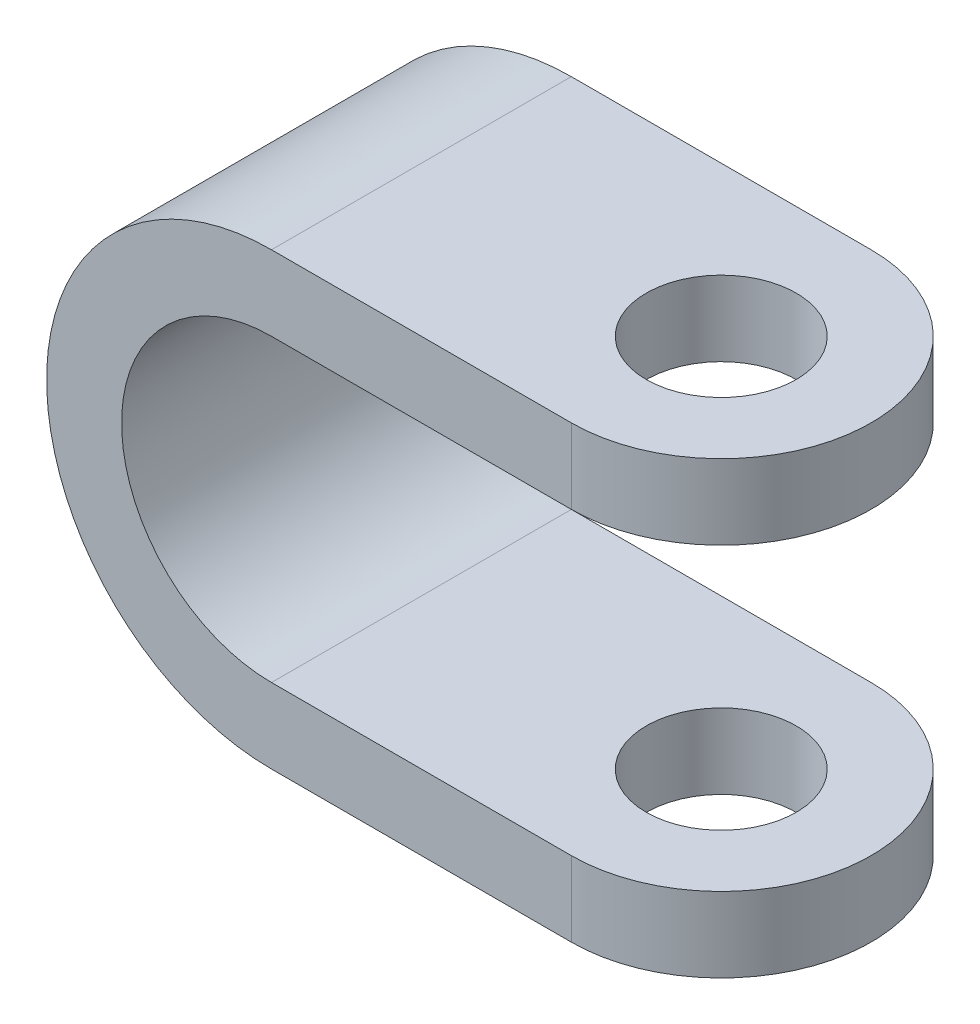
from build123d import *

# Parameters (mm, degrees)
EXTRUDE_THIN1_DEPTH = 90
SKETCH2_R           = 10
BOSS_EXTRUDE1_DEPTH = 90


with BuildPart() as part:
    # Sketch1 → Extrude-Thin1 (new body)
    with BuildSketch(Plane.XY):
        with BuildLine():
            Line((0, -15), (-60, -15))
            ThreePointArc((-60, -15), (-80, -35), (-60, -55))
            Line((-60, -55), (0, -55))
            Line((0, -55), (0, -65))
            Line((0, -65), (-60, -65))
            ThreePointArc((-60, -65), (-90, -35), (-60, -5))
            Line((-60, -5), (0, -5))
            Line((0, -5), (0, -15))
        make_face()
    extrude(amount=EXTRUDE_THIN1_DEPTH)


with BuildPart() as body_2:
    # Sketch2 → Boss-Extrude1 (new body)
    with BuildSketch(Plane(origin=(0, 0, 0), x_dir=(1, 0, 0), z_dir=(0, 1, 0))):
        with BuildLine():
            Line((-90, -25), (-90, -65))
            Line((-90, -65), (-20, -65))
            ThreePointArc((-20, -65), (0, -45), (-20, -25))
            Line((-20, -25), (-90, -25))
        make_face()
        with Locations((-20, -45)):
            Circle(SKETCH2_R, mode=Mode.SUBTRACT)
    extrude(amount=-BOSS_EXTRUDE1_DEPTH)

    # Combine1: intersect part
    add(part.part, mode=Mode.INTERSECT)


solid = body_2.part
